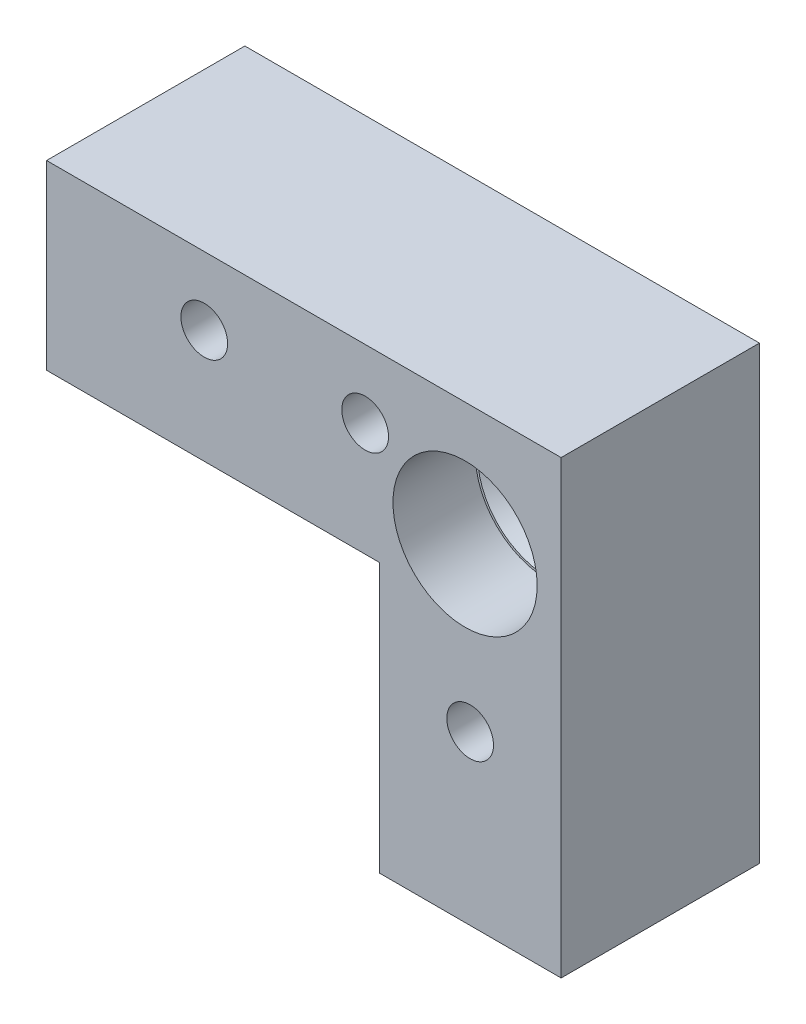
from build123d import *

# Parameters (mm, degrees)
BOSS_EXTRUDE1_DEPTH                              = 42.65
SKETCH2_R                                        = 6.425
CUT_EXTRUDE1_DEPTH                               = 42.65
SKETCH3_W                                        = 1.9
SKETCH3_H                                        = 30
CUT_EXTRUDE2_DEPTH                               = 42.65
SKETCH4_R                                        = 6.425
CUT_EXTRUDE3_DEPTH                               = 42.65
SKETCH5_W                                        = 32
SKETCH5_H                                        = 1.9
CUT_EXTRUDE4_DEPTH                               = 42.65
M3_CLEARANCE_HOLE1_D                             = 3.6
M3_CLEARANCE_HOLE1_DEPTH                         = 10
M3_CLEARANCE_HOLE1_CSINK_D                       = 3.65
M3_CLEARANCE_HOLE1_CSINK_ANGLE                   = 90
M3_CLEARANCE_HOLE1_TIP                           = 1.081549114
SKETCH9_W                                        = 61.993652624
SKETCH9_H                                        = 40.55348858
CUT_EXTRUDE5_DEPTH                               = 61.688696641
SKETCH10_R                                       = 1.825
BOSS_EXTRUDE2_DEPTH                              = 10
CBORE_FOR_1_4_SOCKET_HEAD_CAP_SCREW1_D           = 6.7564
CBORE_FOR_1_4_SOCKET_HEAD_CAP_SCREW1_CBORE_D     = 11.1125
CBORE_FOR_1_4_SOCKET_HEAD_CAP_SCREW1_CBORE_DEPTH = 6.35
SKETCH14_R                                       = 5
CUT_EXTRUDE6_DEPTH                               = 5
CHAMFER1_SIZE                                    = 2


with BuildPart() as part:
    # Sketch1 → Boss-Extrude1 (new body)
    with BuildSketch(Plane.XY):
        Polygon((14, 0), (-25.65, 0), (-25.65, -14), (0, -14), (0, -34.73), (14, -34.73), align=None)
    extrude(amount=BOSS_EXTRUDE1_DEPTH)

    # Sketch2 → Cut-Extrude1 (cut)
    with BuildSketch(Plane.XZ.offset(14)):
        with Locations((-14.665, 27.725)):
            Circle(SKETCH2_R)
    extrude(amount=-CUT_EXTRUDE1_DEPTH, mode=Mode.SUBTRACT)

    # Sketch3 → Cut-Extrude2 (cut)
    with BuildSketch(Plane.XZ.offset(14)):
        with Locations((-16.7, 27.65)):
            Rectangle(SKETCH3_W, SKETCH3_H)
    extrude(amount=-CUT_EXTRUDE2_DEPTH, mode=Mode.SUBTRACT)

    # Sketch4 → Cut-Extrude3 (cut)
    with BuildSketch(Plane.ZY):
        with Locations((18.725, -21.745)):
            Circle(SKETCH4_R)
    extrude(amount=-CUT_EXTRUDE3_DEPTH, mode=Mode.SUBTRACT)

    # Sketch5 → Cut-Extrude4 (cut)
    with BuildSketch(Plane.ZY):
        with Locations((26.65, -25.78)):
            Rectangle(SKETCH5_W, SKETCH5_H)
    extrude(amount=-CUT_EXTRUDE4_DEPTH, mode=Mode.SUBTRACT)

    # M3 Clearance Hole1
    with Locations(Plane(origin=(0, 0, 0), x_dir=(-1, 0, 0), z_dir=(0, 0, -1))):
        with Locations((1.1, -5.25), (13.5, -5.25), (-6.99, -21.8)):
            CounterSinkHole(M3_CLEARANCE_HOLE1_D / 2, M3_CLEARANCE_HOLE1_CSINK_D / 2, depth=M3_CLEARANCE_HOLE1_DEPTH, counter_sink_angle=M3_CLEARANCE_HOLE1_CSINK_ANGLE)
            with Locations((0, 0, -(M3_CLEARANCE_HOLE1_DEPTH + M3_CLEARANCE_HOLE1_TIP / 2))):  # 118° drill point
                Cone(0, M3_CLEARANCE_HOLE1_D / 2, M3_CLEARANCE_HOLE1_TIP, mode=Mode.SUBTRACT)

    # Sketch9 → Cut-Extrude5 (cut, through all)
    with BuildSketch(Plane(origin=(0, 0, 0), x_dir=(1, 0, 0), z_dir=(0, 1, 0))):
        with Locations((-5.42180131, -25.55674429)):
            Rectangle(SKETCH9_W, SKETCH9_H)
    extrude(amount=-CUT_EXTRUDE5_DEPTH, mode=Mode.SUBTRACT)

    # Sketch10 → Boss-Extrude2 (add)
    with BuildSketch(Plane(origin=(0, 0, 0), x_dir=(-1, 0, 0), z_dir=(0, 0, -1))):
        Polygon((25.65, 0), (-14, 0), (-14, -34.73), (0, -34.73), (0, -14), (25.65, -14), align=None)
        with Locations((1.1, -5.25)):
            Circle(SKETCH10_R, mode=Mode.SUBTRACT)
        with Locations((13.5, -5.25)):
            Circle(SKETCH10_R, mode=Mode.SUBTRACT)
        with Locations((-6.99, -21.8)):
            Circle(SKETCH10_R, mode=Mode.SUBTRACT)
    extrude(amount=BOSS_EXTRUDE2_DEPTH)

    # CBORE for 1/4 Socket Head Cap Screw1 (through all)
    with Locations(Plane.XY.offset(5.28)):
        with Locations((6.597752863, -9.469911877)):
            CounterBoreHole(CBORE_FOR_1_4_SOCKET_HEAD_CAP_SCREW1_D / 2, CBORE_FOR_1_4_SOCKET_HEAD_CAP_SCREW1_CBORE_D / 2, CBORE_FOR_1_4_SOCKET_HEAD_CAP_SCREW1_CBORE_DEPTH)

    # Sketch14 → Cut-Extrude6 (cut)
    with BuildSketch(Plane(origin=(0, 0, -10), x_dir=(-1, 0, 0), z_dir=(0, 0, -1))):
        with Locations((1.1, -5.25)):
            Circle(SKETCH14_R)
        with Locations((13.5, -5.25)):
            Circle(SKETCH14_R)
        with Locations((-6.99, -21.8)):
            Circle(SKETCH14_R)
    extrude(amount=-CUT_EXTRUDE6_DEPTH, mode=Mode.SUBTRACT)

    # Chamfer1
    chamfer1_edges = [part.edges().sort_by_distance(p)[0] for p in [
        (9.975952863, -9.469911877, -1.07),
    ]]
    chamfer(chamfer1_edges, length=CHAMFER1_SIZE)


solid = part.part
